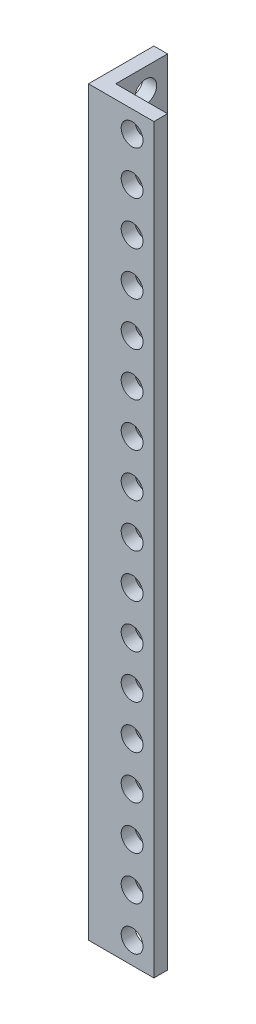
from build123d import *

# Parameters (mm, degrees)
SKETCH1_W                = 136
SKETCH1_H                = 12
BOSS_EXTRUDE1_DEPTH      = 12
SKETCH2_W                = 9.5
SKETCH2_H                = 9.5
CUT_EXTRUDE1_DEPTH       = 138.054733592
F_4_0_4_DIAMETER_HOLE1_D = 4
F_4_0_4_DIAMETER_HOLE2_D = 4


with BuildPart() as part:
    # Sketch1 → Boss-Extrude1 (new body)
    with BuildSketch(Plane(origin=(0, 0, 0), x_dir=(0, -1, 0), z_dir=(-1, 0, 0))):
        with Locations((-68, -6)):
            Rectangle(SKETCH1_W, SKETCH1_H)
    extrude(amount=-BOSS_EXTRUDE1_DEPTH)

    # Sketch2 → Cut-Extrude1 (cut, through all)
    with BuildSketch(Plane.XZ):
        with Locations((7.25, -7.25)):
            Rectangle(SKETCH2_W, SKETCH2_H)
    extrude(amount=-CUT_EXTRUDE1_DEPTH, mode=Mode.SUBTRACT)

    # Ø4.0 (4) Diameter Hole1 (through all)
    with Locations(Plane(origin=(0, 0, -2.5), x_dir=(-1, 0, 0), z_dir=(0, 0, -1))):
        with Locations((-8, 4), (-8, 12), (-8, 20), (-8, 28), (-8, 36), (-8, 44), (-8, 52), (-8, 60), (-8, 68), (-8, 76), (-8, 84), (-8, 92), (-8, 100), (-8, 108), (-8, 116), (-8, 124), (-8, 132)):
            Hole(F_4_0_4_DIAMETER_HOLE1_D / 2)

    # Ø4.0 (4) Diameter Hole2 (through all)
    with Locations(Plane(origin=(2.5, 0, 0), x_dir=(0, 0, -1), z_dir=(1, 0, 0))):
        with Locations((8, 12), (8, 4), (8, 20), (8, 28), (8, 36), (8, 44), (8, 52), (8, 60), (8, 68), (8, 76), (8, 84), (8, 92), (8, 100), (8, 108), (8, 116), (8, 124), (8, 132)):
            Hole(F_4_0_4_DIAMETER_HOLE2_D / 2)


solid = part.part
